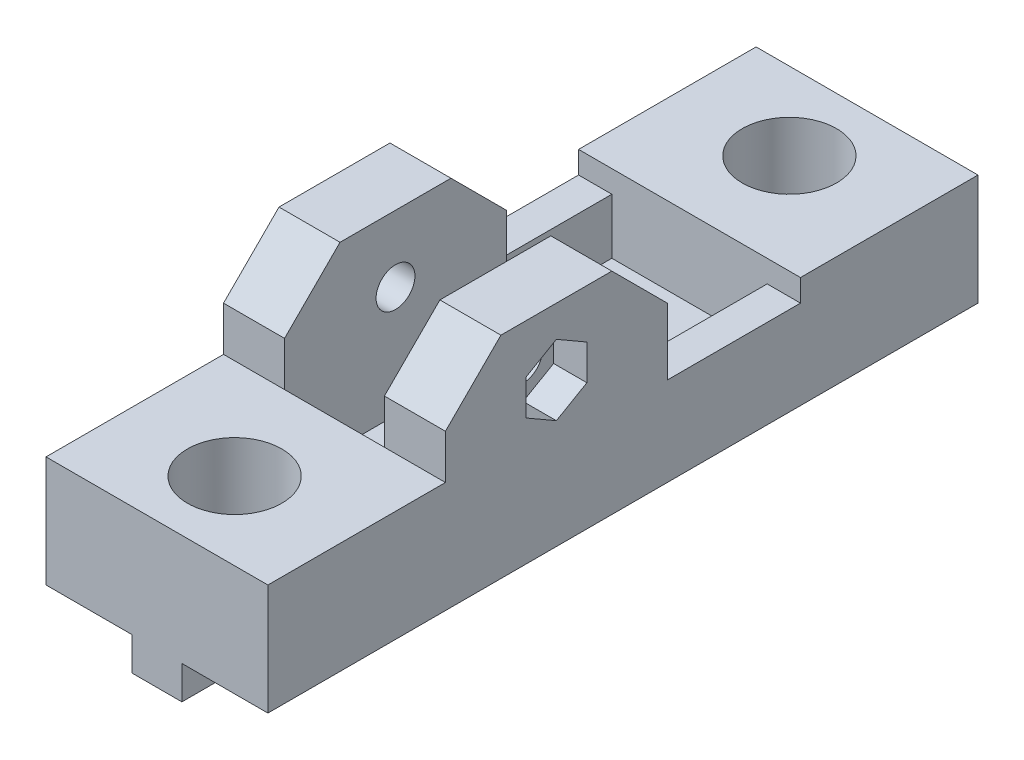
from build123d import *

# Parameters (mm, degrees)
SKETCH1_W               = 20
SKETCH1_H               = 30
BOSS_EXTRUDE1_DEPTH     = 3
SKETCH2_W               = 4.5
SKETCH2_H               = 12
BOSS_EXTRUDE2_DEPTH     = 3
SKETCH3_R               = 7
SKETCH3_R_2             = 4.25
BOSS_EXTRUDE3_DEPTH     = 7
SKETCH4_R               = 4.25
BOSS_EXTRUDE4_DEPTH     = 1
CUT_EXTRUDE1_DEPTH      = 20.339079606
CUT_EXTRUDE1_DEPTH_BACK = 20.339079606
SKETCH5_R               = 3
SKETCH6_R               = 7
SKETCH6_R_2             = 4.25
BOSS_EXTRUDE6_DEPTH     = 7
SKETCH7_W               = 20
SKETCH7_H               = 3
BOSS_EXTRUDE7_DEPTH     = 19
SKETCH8_W               = 4.5
SKETCH8_H               = 3
BOSS_EXTRUDE8_DEPTH     = 12
SKETCH10_W              = 5.5
SKETCH10_H              = 20
BOSS_EXTRUDE9_DEPTH     = 16
CUT_EXTRUDE2_DEPTH      = 57.231663678
CUT_EXTRUDE2_DEPTH_BACK = 57.231663678
SKETCH11_R              = 1.75
SKETCH12_R              = 3
SKETCH12_R_2            = 1.75
CUT_EXTRUDE3_DEPTH      = 3
CUT_EXTRUDE4_START      = -3
SKETCH13_R              = 1.75
CUT_EXTRUDE4_DEPTH      = 3
CHAMFER2_SIZE           = 5
CUT_EXTRUDE5_START      = -1.5
SKETCH14_R              = 4.25
CUT_EXTRUDE5_DEPTH      = 1.5
SKETCH15_W              = 3
SKETCH15_H              = 12
BOSS_EXTRUDE10_DEPTH    = 5


with BuildPart() as part:
    # Sketch1 → Boss-Extrude1 (new body)
    with BuildSketch(Plane(origin=(0, 0, 0), x_dir=(1, 0, 0), z_dir=(0, 1, 0))):
        Rectangle(SKETCH1_W, SKETCH1_H)
    boss_extrude1 = extrude(amount=BOSS_EXTRUDE1_DEPTH)

    # Sketch2 → Boss-Extrude2 (add)
    with BuildSketch(Plane.XZ):
        with Locations((0, -9)):
            Rectangle(SKETCH2_W, SKETCH2_H)
    boss_extrude2 = extrude(amount=BOSS_EXTRUDE2_DEPTH)

    # Sketch3 → Boss-Extrude3 (add)
    with BuildSketch(Plane(origin=(0, 3, 0), x_dir=(1, 0, 0), z_dir=(0, 1, 0))):
        with Locations(Location((0, 8, 0), (0, 0, 90))):
            Circle(SKETCH3_R)
        with Locations(Location((0, 8, 0), (0, 0, 270))):
            Circle(SKETCH3_R_2, mode=Mode.SUBTRACT)
    boss_extrude3 = extrude(amount=BOSS_EXTRUDE3_DEPTH)

    # Sketch4 → Boss-Extrude4 (add)
    with BuildSketch(Plane(origin=(0, 3, 0), x_dir=(1, 0, 0), z_dir=(0, 1, 0))):
        with Locations(Location((0, 8, 0), (0, 0, 270))):
            Circle(SKETCH4_R)
    boss_extrude4 = extrude(amount=BOSS_EXTRUDE4_DEPTH)

    # Sketch5 → Cut-Extrude1 (cut, two sides: drawn at the far end of the back side and taken through both)
    with BuildSketch(Plane(origin=(0, 3, 0), x_dir=(1, 0, 0), z_dir=(0, 1, 0)).offset(-CUT_EXTRUDE1_DEPTH_BACK)):
        with Locations(Location((0, -8.5, 0), (0, 0, 90))):
            Circle(SKETCH5_R)
    extrude(amount=CUT_EXTRUDE1_DEPTH + CUT_EXTRUDE1_DEPTH_BACK, mode=Mode.SUBTRACT)

    # Sketch6 → Boss-Extrude6 (add)
    # profile 1 of 2: a face of its own
    with BuildSketch(Plane(origin=(0, 3, 0), x_dir=(1, 0, 0), z_dir=(0, 1, 0))):
        Polygon((0, 15), (-10, 15), (-10, -1), (10, -1), (10, 15), align=None)
        with BuildLine():
            ThreePointArc((7, 8), (-4.949747468, 3.050252532), (0, 15))
            ThreePointArc((0, 15), (4.949747468, 12.949747468), (7, 8))
        make_face(mode=Mode.SUBTRACT)
    # profile 2 of 2: a face of its own
    with BuildSketch(Plane(origin=(0, 3, 0), x_dir=(1, 0, 0), z_dir=(0, 1, 0))):
        with Locations((0, 8)):
            Circle(SKETCH6_R)
        with Locations(Location((0, 8, 0), (0, 0, 270))):
            Circle(SKETCH6_R_2, mode=Mode.SUBTRACT)
    boss_extrude6 = extrude(amount=BOSS_EXTRUDE6_DEPTH)

    # Sketch7 → Boss-Extrude7 (add)
    with BuildSketch(Plane.XY.offset(15)):
        with Locations((0, 1.5)):
            Rectangle(SKETCH7_W, SKETCH7_H)
    extrude(amount=BOSS_EXTRUDE7_DEPTH)

    # Mirror3: Boss-Extrude1, Boss-Extrude2, Boss-Extrude3, Boss-Extrude4, Boss-Extrude6 across plane
    add(boss_extrude1.mirror(Plane.XY.offset(17)))
    add(boss_extrude2.mirror(Plane.XY.offset(17)))
    add(boss_extrude3.mirror(Plane.XY.offset(17)))
    add(boss_extrude4.mirror(Plane.XY.offset(17)))
    add(boss_extrude6.mirror(Plane.XY.offset(17)))

    # Sketch8 → Boss-Extrude8 (add)
    with BuildSketch(Plane(origin=(0, 0, 37), x_dir=(-1, 0, 0), z_dir=(0, 0, -1))):
        with Locations((0, -1.5)):
            Rectangle(SKETCH8_W, SKETCH8_H)
    extrude(amount=BOSS_EXTRUDE8_DEPTH)

    # Sketch10 → Boss-Extrude9 (add)
    with BuildSketch(Plane(origin=(0, 3, 0), x_dir=(1, 0, 0), z_dir=(0, 1, 0))):
        with Locations((-7.25, -23)):
            Rectangle(SKETCH10_W, SKETCH10_H)
        with Locations((7.25, -23)):
            Rectangle(SKETCH10_W, SKETCH10_H)
    extrude(amount=BOSS_EXTRUDE9_DEPTH)

    # Sketch11 → Cut-Extrude2 (cut, two sides: drawn at the far end of the back side and taken through both)
    with BuildSketch(Plane.ZY.offset(10).offset(-CUT_EXTRUDE2_DEPTH_BACK)):
        with Locations((23, 13)):
            Circle(SKETCH11_R)
    extrude(amount=CUT_EXTRUDE2_DEPTH + CUT_EXTRUDE2_DEPTH_BACK, mode=Mode.SUBTRACT)

    # Sketch12 → Cut-Extrude3 (cut)
    with BuildSketch(Plane.ZY.offset(10)):
        with Locations((23, 13)):
            Circle(SKETCH12_R)
        with Locations((23, 13)):
            Circle(SKETCH12_R_2, mode=Mode.SUBTRACT)
    extrude(amount=-CUT_EXTRUDE3_DEPTH, mode=Mode.SUBTRACT)

    # Sketch13 → Cut-Extrude4 (cut)
    with BuildSketch(Plane(origin=(10, 0, 0), x_dir=(0, 0, -1), z_dir=(1, 0, 0)).offset(CUT_EXTRUDE4_START)):
        Polygon((-23, 16.175426481), (-25.75, 14.58771324), (-25.75, 11.41228676), (-23, 9.824573519), (-20.25, 11.41228676), (-20.25, 14.58771324), align=None)
        with Locations((-23, 13)):
            Circle(SKETCH13_R, mode=Mode.SUBTRACT)
    extrude(amount=CUT_EXTRUDE4_DEPTH, mode=Mode.SUBTRACT)

    # Chamfer2
    chamfer2_edges = [part.edges().sort_by_distance(p)[0] for p in [
        (-7.25, 19, 13),
        (-7.25, 19, 33),
        (7.25, 19, 13),
        (7.25, 19, 33),
    ]]
    chamfer(chamfer2_edges, length=CHAMFER2_SIZE)

    # Sketch14 → Cut-Extrude5 (cut)
    with BuildSketch(Plane(origin=(0, 4, 0), x_dir=(1, 0, 0), z_dir=(0, 1, 0)).offset(CUT_EXTRUDE5_START)):
        with Locations(Location((0, -42, 0), (0, 0, 90))):
            Circle(SKETCH14_R)
        with Locations(Location((0, 8, 0), (0, 0, 270))):
            Circle(SKETCH14_R)
    extrude(amount=CUT_EXTRUDE5_DEPTH, mode=Mode.SUBTRACT)

    # Sketch15 → Boss-Extrude10 (add)
    with BuildSketch(Plane(origin=(0, 3, 0), x_dir=(1, 0, 0), z_dir=(0, 1, 0))):
        with Locations((-8.5, -7)):
            Rectangle(SKETCH15_W, SKETCH15_H)
        with Locations((8.5, -7)):
            Rectangle(SKETCH15_W, SKETCH15_H)
    extrude(amount=BOSS_EXTRUDE10_DEPTH)


solid = part.part
